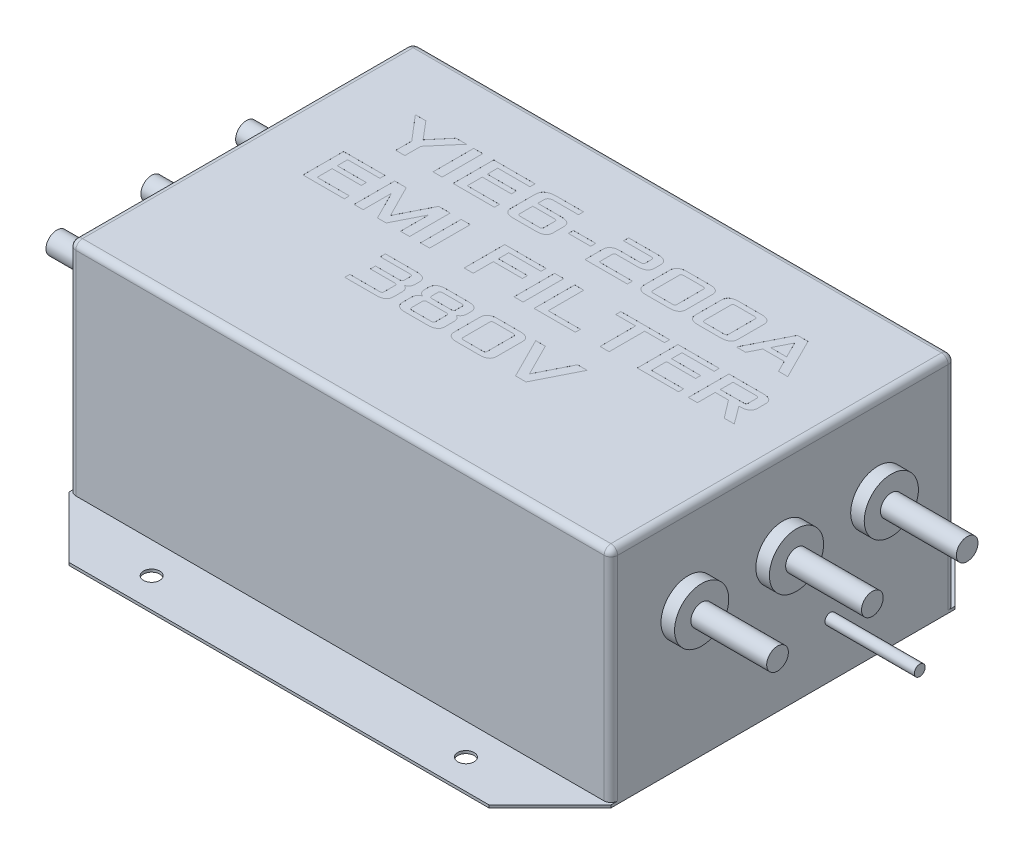
from build123d import *

# Parameters (mm, degrees)
SKETCH1_R           = 3
BOSS_EXTRUDE1_DEPTH = 1
SKETCH2_W           = 200
SKETCH2_H           = 127
BOSS_EXTRUDE2_DEPTH = 81
FILLET3_R           = 2.5
SKETCH3_R           = 4
SKETCH3_R_2         = 2
BOSS_EXTRUDE3_DEPTH = 133
BOSS_EXTRUDE4_START = -133
SKETCH3_2_R         = 4
BOSS_EXTRUDE4_DEPTH = 133
SKETCH4_W           = 3.359791589
SKETCH4_H           = 15
SKETCH4_W_2         = 8.227516457
SKETCH4_H_2         = 1.878310108
SKETCH4_W_3         = 3.35979159
CUT_EXTRUDE1_DEPTH  = 0.01
SKETCH5_R           = 10
BOSS_EXTRUDE5_DEPTH = 105


with BuildPart() as part:
    # Sketch1 → Boss-Extrude1 (new body)
    with BuildSketch(Plane(origin=(0, 0, 0), x_dir=(1, 0, 0), z_dir=(0, 1, 0))):
        Polygon((-77.5, 86), (77.5, 86), (100, 63.5), (100, -63.5), (77.5, -86), (-77.5, -86), (-100, -63.5), (-100, 63.5), align=None)
        with Locations(Location((-58, 75, 0), (0, 0, 270))):
            Circle(SKETCH1_R, mode=Mode.SUBTRACT)
        with Locations(Location((58, 75, 0), (0, 0, 90))):
            Circle(SKETCH1_R, mode=Mode.SUBTRACT)
        with Locations(Location((58, -75, 0), (0, 0, 270))):
            Circle(SKETCH1_R, mode=Mode.SUBTRACT)
        with Locations(Location((-58, -75, 0), (0, 0, 90))):
            Circle(SKETCH1_R, mode=Mode.SUBTRACT)
    extrude(amount=BOSS_EXTRUDE1_DEPTH)

    # Sketch2 → Boss-Extrude2 (add)
    with BuildSketch(Plane(origin=(0, 1, 0), x_dir=(1, 0, 0), z_dir=(0, 1, 0))):
        Rectangle(SKETCH2_W, SKETCH2_H)
    extrude(amount=BOSS_EXTRUDE2_DEPTH)

    # Fillet3
    fillet3_edges = [part.edges().sort_by_distance(p)[0] for p in [
        (-100, 41.5, -63.5),
        (-100, 41.5, 63.5),
        (100, 41.5, 63.5),
        (100, 41.5, -63.5),
        (-100, 82, 0),
        (0, 82, 63.5),
        (100, 82, 0),
        (0, 82, -63.5),
    ]]
    fillet(fillet3_edges, radius=FILLET3_R)

    # Sketch3 → Boss-Extrude3 (add)
    with BuildSketch(Plane(origin=(0, 0, 0), x_dir=(0, 0, -1), z_dir=(1, 0, 0))):
        with Locations(Location((-35, 50, 0), (0, 0, 180))):
            Circle(SKETCH3_R)
        with Locations(Location((35, 50, 0), (0, 0, 180))):
            Circle(SKETCH3_R)
        with Locations(Location((0, 50, 0), (0, 0, 180))):
            Circle(SKETCH3_R)
        with Locations(Location((17.5, 20, 0), (0, 0, 180))):
            Circle(SKETCH3_R_2)
    extrude(amount=BOSS_EXTRUDE3_DEPTH)

    # Sketch3<2> → Boss-Extrude4 (add)
    with BuildSketch(Plane(origin=(0, 0, 0), x_dir=(0, 0, -1), z_dir=(1, 0, 0)).offset(BOSS_EXTRUDE4_START)):
        with Locations(Location((-35, 50, 0), (0, 0, 180))):
            Circle(SKETCH3_2_R)
        with Locations(Location((35, 50, 0), (0, 0, 180))):
            Circle(SKETCH3_2_R)
        with Locations(Location((0, 50, 0), (0, 0, 180))):
            Circle(SKETCH3_2_R)
    extrude(amount=BOSS_EXTRUDE4_DEPTH)

    # Sketch4 → Cut-Extrude1 (cut)
    # profile 1 of 22: a face of its own
    with BuildSketch(Plane(origin=(0, 82, 0), x_dir=(1, 0, 0), z_dir=(0, 1, 0))):
        Polygon((-75.688497689, 40.013224284), (-67.916946143, 30.922589983), (-67.916946143, 25.013224284), (-64.557157783, 25.013224284), (-64.557157783, 30.922589983), (-56.785606237, 40.013224284), (-60.67138201, 40.013224284), (-66.237026128, 33.422706241), (-71.802721916, 40.013224284), align=None)
    # profile 2 of 22: a face of its own
    with BuildSketch(Plane(origin=(0, 82, 0), x_dir=(1, 0, 0), z_dir=(0, 1, 0))):
        with Locations((-52.480436592, 32.513224284)):
            Rectangle(SKETCH4_W, SKETCH4_H)
    # profile 3 of 22: a face of its own
    with BuildSketch(Plane(origin=(0, 82, 0), x_dir=(1, 0, 0), z_dir=(0, 1, 0))):
        Polygon((-46.752924979, 25.013227513), (-31.507231025, 25.013227513), (-31.507231025, 26.891534392), (-43.39313339, 26.891534392), (-43.39313339, 32.420631691), (-32.650106253, 32.420631691), (-32.650106253, 34.298941799), (-43.39313339, 34.298941799), (-43.39313339, 38.134914176), (-31.507231025, 38.134914176), (-31.507231025, 40.013224284), (-46.752924979, 40.013224284), align=None)
    # profile 4 of 22: a face of its own
    with BuildSketch(Plane(origin=(0, 82, 0), x_dir=(1, 0, 0), z_dir=(0, 1, 0))):
        with BuildLine():
            add(Edge.make_bspline(
                [(-28.128586355, 27.697876622), (-28.125461153, 27.587634896), (-28.119426591, 27.374765281), (-28.071589412, 27.066843581), (-27.997291669, 26.780933616), (-27.888296367, 26.517185867), (-27.759007455, 26.271018057), (-27.592929293, 26.050120776), (-27.399659783, 25.850149138), (-27.177818225, 25.672535736), (-26.93016046, 25.515769129), (-26.658072306, 25.381232351), (-26.363164747, 25.264587742), (-26.043769, 25.173329976), (-25.702299616, 25.100935805), (-25.336816207, 25.047540146), (-24.946734883, 25.018816898), (-24.678451135, 25.01512449), (-24.540620162, 25.013227513)],
                knots=[0, 0, 0, 0, 1.039968639, 2.008111906, 2.934259747, 3.821004225, 4.696138303, 5.551318514, 6.419499089, 7.314746791, 8.226763131, 9.180546054, 10.175484658, 11.215837561, 12.311571692, 13.468002448, 14.699184398, 16, 16, 16, 16], degree=3))
            Line((-24.540620162, 25.013227513), (-16.081715876, 25.013227513))
            add(Edge.make_bspline(
                [(-16.081715876, 25.013227513), (-15.944957725, 25.01514742), (-15.677747699, 25.018898702), (-15.2887363, 25.047539404), (-14.923252875, 25.100935988), (-14.581783495, 25.173329931), (-14.262387746, 25.264587754), (-13.967480187, 25.381232348), (-13.695392034, 25.51576913), (-13.447734269, 25.672535736), (-13.225892712, 25.850149138), (-13.032623196, 26.050120777), (-12.866545056, 26.271018055), (-12.737256061, 26.517185878), (-12.628261079, 26.780933574), (-12.553962068, 27.06684375), (-12.506271925, 27.373850936), (-12.500134801, 27.585790631), (-12.496969369, 27.69510582)],
                knots=[0, 0, 0, 0, 1.292219667, 2.524851705, 3.682644506, 4.779669194, 5.821247426, 6.817357869, 7.772264159, 8.685354672, 9.581656798, 10.450859917, 11.30704736, 12.183212171, 13.071001058, 13.998239717, 14.967523264, 16, 16, 16, 16], degree=3))
            Line((-12.496969369, 27.69510582), (-12.49366572, 31.61439603))
            add(Edge.make_bspline(
                [(-12.49366572, 31.61439603), (-12.498259877, 31.723473425), (-12.507173001, 31.935094423), (-12.553576394, 32.2421081), (-12.629205017, 32.528643028), (-12.735466639, 32.79363061), (-12.867687971, 33.038334607), (-13.032471573, 33.258820229), (-13.225936163, 33.458687621), (-13.447717672, 33.636348477), (-13.695414456, 33.793030312), (-13.967402942, 33.927875258), (-14.262984285, 34.043414709), (-14.581172488, 34.139602834), (-14.923024305, 34.212246382), (-15.289215081, 34.259080319), (-15.678591945, 34.294867327), (-15.947054803, 34.297559268), (-16.084932332, 34.298941799)],
                knots=[0, 0, 0, 0, 1.030299487, 1.99888351, 2.925452989, 3.822256577, 4.688646985, 5.544216526, 6.412792348, 7.30844762, 8.220879164, 9.175096306, 10.170487865, 11.214276539, 12.310509514, 13.466014488, 14.698592189, 16, 16, 16, 16], degree=3))
            Line((-16.084932332, 34.298941799), (-24.768794765, 34.298941799))
            Line((-24.768794765, 34.298941799), (-24.768794765, 36.507526378))
            add(Edge.make_bspline(
                [(-24.768794765, 36.507526378), (-24.763073886, 36.632977351), (-24.75220461, 36.871325521), (-24.653299519, 37.204701469), (-24.493105708, 37.49373793), (-24.256048909, 37.72468875), (-23.959327321, 37.90767448), (-23.598101571, 38.032114331), (-23.176509148, 38.116663413), (-22.873335923, 38.126419365), (-22.711916459, 38.131613757)],
                knots=[0, 0, 0, 0, 1.008225341, 1.915558388, 2.774473871, 3.64079039, 4.54985913, 5.560932089, 6.701359478, 8, 8, 8, 8], degree=3))
            Line((-22.711916459, 38.131613757), (-13.613563956, 38.134914176))
            Line((-13.613563956, 38.134914176), (-13.613563956, 40.013224284))
            Line((-13.613563956, 40.013224284), (-23.625758069, 40.013224284))
            add(Edge.make_bspline(
                [(-23.625758069, 40.013224284), (-23.799584275, 40.00908117), (-24.135860991, 40.001066081), (-24.626158639, 39.966946447), (-25.085730519, 39.900749043), (-25.515315556, 39.808265034), (-25.916837352, 39.693817128), (-26.285828308, 39.548091484), (-26.627922938, 39.378745561), (-26.938897932, 39.182197679), (-27.214178901, 38.954610098), (-27.460547867, 38.707201454), (-27.662672601, 38.424006596), (-27.832385537, 38.117296889), (-27.961387908, 37.78058646), (-28.057024203, 37.419353795), (-28.117375351, 37.030180065), (-28.126962317, 36.761683895), (-28.131890004, 36.623677249)],
                knots=[0, 0, 0, 0, 1.304266825, 2.523178617, 3.684378229, 4.783973007, 5.817572836, 6.81258112, 7.755550507, 8.677660593, 9.564891512, 10.430315211, 11.288718468, 12.165757005, 13.053296124, 13.985949166, 14.964780756, 16, 16, 16, 16], degree=3))
            Line((-28.131890004, 36.623677249), (-28.128586355, 27.697876622))
        make_face()
        with BuildLine():
            Line((-24.768794765, 27.582684875), (-24.768794765, 32.420631691))
            Line((-24.768794765, 32.420631691), (-16.767537893, 32.420631691))
            add(Edge.make_bspline(
                [(-16.767537893, 32.420631691), (-16.698619224, 32.417806419), (-16.568105021, 32.412456082), (-16.385652359, 32.380874642), (-16.229845243, 32.326769192), (-16.095471909, 32.256555771), (-15.99533724, 32.151776512), (-15.916345224, 32.031840345), (-15.869534769, 31.886914775), (-15.861168457, 31.783839006), (-15.856757728, 31.729497354)],
                knots=[0, 0, 0, 0, 1.28068808, 2.425293237, 3.422506462, 4.339334478, 5.208028714, 6.082734747, 6.989215783, 8, 8, 8, 8], degree=3))
            Line((-15.856757728, 31.729497354), (-15.853457309, 27.582684875))
            add(Edge.make_bspline(
                [(-15.853457309, 27.582684875), (-15.859261006, 27.528371635), (-15.870255312, 27.42548268), (-15.916191857, 27.280368402), (-15.995252338, 27.160165872), (-16.096356813, 27.056099722), (-16.228769383, 26.981274433), (-16.385838236, 26.928465736), (-16.568579309, 26.895429222), (-16.699860068, 26.8928838), (-16.769456141, 26.891534392)],
                knots=[0, 0, 0, 0, 1.010554323, 1.914356021, 2.786476635, 3.652603221, 4.576922577, 5.571188282, 6.712410263, 8, 8, 8, 8], degree=3))
            Line((-16.769456141, 26.891534392), (-23.854365409, 26.891534392))
            add(Edge.make_bspline(
                [(-23.854365409, 26.891534392), (-23.92454078, 26.892852706), (-24.056402911, 26.895329869), (-24.239713093, 26.928465106), (-24.396787306, 26.981274059), (-24.529181417, 27.056101572), (-24.630349983, 27.160159265), (-24.709169905, 27.280393734), (-24.756028485, 27.425235886), (-24.764387752, 27.528323867), (-24.768794765, 27.582684875)],
                knots=[0, 0, 0, 0, 1.29698023, 2.437074068, 3.430356903, 4.353762533, 5.21903292, 6.090291408, 6.993199663, 8, 8, 8, 8], degree=3))
        make_face(mode=Mode.SUBTRACT)
    # profile 5 of 22: a face of its own
    with BuildSketch(Plane(origin=(0, 82, 0), x_dir=(1, 0, 0), z_dir=(0, 1, 0))):
        with Locations((-5.390489502, 31.243384629)):
            Rectangle(SKETCH4_W_2, SKETCH4_H_2)
    # profile 6 of 22: a face of its own
    with BuildSketch(Plane(origin=(0, 82, 0), x_dir=(1, 0, 0), z_dir=(0, 1, 0))):
        with BuildLine():
            Line((1.924323698, 25.013227513), (17.559244333, 25.013227513))
            Line((17.559244333, 25.013227513), (17.559244333, 26.891534392))
            Line((17.559244333, 26.891534392), (5.284115288, 26.891534392))
            Line((5.284115288, 26.891534392), (5.284115288, 31.729587777))
            add(Edge.make_bspline(
                [(5.284115288, 31.729587777), (5.288528776, 31.783898972), (5.296902501, 31.886943763), (5.343702609, 32.031839659), (5.422694715, 32.151779036), (5.522829985, 32.256546175), (5.657200619, 32.326808654), (5.813019432, 32.38070305), (5.995990453, 32.413340131), (6.127236192, 32.415946385), (6.1968137, 32.417328042)],
                knots=[0, 0, 0, 0, 1.008946754, 1.914277678, 2.787873913, 3.655465979, 4.571130755, 5.56707875, 6.71023167, 8, 8, 8, 8], degree=3))
            Line((6.1968137, 32.417328042), (13.971194177, 32.420631691))
            add(Edge.make_bspline(
                [(13.971194177, 32.420631691), (14.108014279, 32.420598432), (14.37545505, 32.420533419), (14.763583203, 32.457852649), (15.130487977, 32.502441763), (15.470617724, 32.582117807), (15.790591793, 32.671635286), (16.085415763, 32.788727743), (16.357509821, 32.923162913), (16.605219222, 33.079917), (16.826856478, 33.257670689), (17.021485283, 33.457751708), (17.185225564, 33.6814419), (17.316690731, 33.928528418), (17.423832941, 34.194192914), (17.499503437, 34.481838786), (17.546347078, 34.790137325), (17.552687257, 35.003135194), (17.555940684, 35.112433862)],
                knots=[0, 0, 0, 0, 1.289612717, 2.520792012, 3.674986021, 4.772194003, 5.81183968, 6.806101929, 7.759236475, 8.67063283, 9.565271947, 10.432862337, 11.295830876, 12.170370041, 13.06615617, 13.991674421, 14.969438933, 16, 16, 16, 16], degree=3))
            Line((17.555940684, 35.112433862), (17.559244333, 37.321215433))
            add(Edge.make_bspline(
                [(17.559244333, 37.321215433), (17.55454573, 37.429463063), (17.545349381, 37.641330933), (17.499714413, 37.9487284), (17.423779656, 38.236359697), (17.31670445, 38.502027923), (17.18522196, 38.749113351), (17.02148632, 38.972804295), (16.826855917, 39.172883349), (16.60522044, 39.350644408), (16.357505362, 39.507369951), (16.085433481, 39.641918388), (15.790521272, 39.758559665), (15.471126858, 39.849818386), (15.129657088, 39.922212281), (14.764173791, 39.97560802), (14.374092435, 40.004331245), (14.105808691, 40.008023656), (13.967977721, 40.009920635)],
                knots=[0, 0, 0, 0, 1.021455309, 1.999245252, 2.924787575, 3.820597003, 4.695158915, 5.558149898, 6.425762854, 7.32042524, 8.2318453, 9.185004636, 10.179292746, 11.218965463, 12.313983199, 13.469657876, 14.700034876, 16, 16, 16, 16], degree=3))
            Line((13.967977721, 40.009920635), (3.044270375, 40.013224284))
            Line((3.044270375, 40.013224284), (3.044270375, 38.134914176))
            Line((3.044270375, 38.134914176), (13.28537216, 38.134914176))
            add(Edge.make_bspline(
                [(13.28537216, 38.134914176), (13.354244986, 38.131963233), (13.484672436, 38.126374905), (13.668068388, 38.096321355), (13.822376475, 38.036946862), (13.957541221, 37.96777619), (14.057485181, 37.862673824), (14.137403306, 37.742031489), (14.182836159, 37.59548573), (14.191585816, 37.491460717), (14.196152325, 37.437169312)],
                knots=[0, 0, 0, 0, 1.276480994, 2.417327238, 3.418155698, 4.331972828, 5.197814251, 6.069647727, 6.992535224, 8, 8, 8, 8], degree=3))
            Line((14.196152325, 37.437169312), (14.199452744, 34.996389561))
            add(Edge.make_bspline(
                [(14.199452744, 34.996389561), (14.19359898, 34.941098933), (14.182492523, 34.836194983), (14.137360483, 34.688753037), (14.058647775, 34.56765306), (13.955367309, 34.466800297), (13.823635319, 34.392610918), (13.66782312, 34.334774381), (13.484214573, 34.303189756), (13.353009736, 34.300413552), (13.283453912, 34.298941799)],
                knots=[0, 0, 0, 0, 1.024957902, 1.944671919, 2.81350747, 3.662112369, 4.582950044, 5.580337012, 6.717260293, 8, 8, 8, 8], degree=3))
            Line((13.283453912, 34.298941799), (5.512722627, 34.298941799))
            add(Edge.make_bspline(
                [(5.512722627, 34.298941799), (5.374700692, 34.29756314), (5.106093287, 34.294880102), (4.71657262, 34.259080424), (4.350381869, 34.212246356), (4.008530046, 34.13960284), (3.690341844, 34.043414708), (3.394760501, 33.927875259), (3.122772015, 33.793030312), (2.875075232, 33.636348477), (2.653293722, 33.458687621), (2.459829135, 33.258820229), (2.295045517, 33.038334607), (2.162824246, 32.793630609), (2.05656239, 32.528643031), (1.980934685, 32.242108086), (1.934495737, 31.934883597), (1.925606316, 31.723047807), (1.921020049, 31.613756614)],
                knots=[0, 0, 0, 0, 1.302495012, 2.534813073, 3.690074641, 4.786076696, 5.829645498, 6.824827379, 7.778843516, 8.691082858, 9.586549462, 10.45494232, 11.310331636, 12.176539541, 13.073154217, 13.999528516, 14.967908509, 16, 16, 16, 16], degree=3))
            Line((1.921020049, 31.613756614), (1.924323698, 25.013227513))
        make_face()
    # profile 7 of 22: a face of its own
    with BuildSketch(Plane(origin=(0, 82, 0), x_dir=(1, 0, 0), z_dir=(0, 1, 0))):
        with BuildLine():
            add(Edge.make_bspline(
                [(20.971942746, 27.694598808), (20.975118189, 27.584363697), (20.981249504, 27.371515867), (21.028241549, 27.064418732), (21.104780783, 26.779293338), (21.210391622, 26.515215511), (21.342677928, 26.270531808), (21.50744487, 26.050042105), (21.700912518, 25.850171074), (21.922698925, 25.672529668), (22.170372028, 25.515770849), (22.442455826, 25.381231859), (22.73736463, 25.264587883), (23.056760021, 25.173329935), (23.398229508, 25.100935817), (23.763712887, 25.047540143), (24.15379422, 25.018816899), (24.422077966, 25.015124491), (24.559908938, 25.013227513)],
                knots=[0, 0, 0, 0, 1.040674086, 2.009389013, 2.926031417, 3.822956207, 4.689463707, 5.545148877, 6.413842087, 7.309618406, 8.222173265, 9.176519368, 10.172045454, 11.213012655, 12.309393785, 13.466507378, 14.698416305, 16, 16, 16, 16], degree=3))
            Line((24.559908938, 25.013227513), (33.018813225, 25.013227513))
            add(Edge.make_bspline(
                [(33.018813225, 25.013227513), (33.155571375, 25.01514742), (33.4227814, 25.018898703), (33.811792808, 25.047539401), (34.177276203, 25.100936), (34.518745686, 25.17332989), (34.838141078, 25.264587894), (35.133049881, 25.381231856), (35.405133679, 25.515770849), (35.652806783, 25.672529668), (35.874593187, 25.850171073), (36.068060843, 26.050042106), (36.232827759, 26.270531806), (36.365114162, 26.515215519), (36.470724625, 26.779293308), (36.547265328, 27.06441885), (36.59411006, 27.370591476), (36.600344239, 27.582499888), (36.603559732, 27.691798942)],
                knots=[0, 0, 0, 0, 1.292990977, 2.526358757, 3.68484263, 4.782522118, 5.824722055, 6.821427064, 7.776903325, 8.690538851, 9.587375968, 10.457097903, 11.313796394, 12.181330032, 13.079316979, 13.997044892, 14.966906992, 16, 16, 16, 16], degree=3))
            Line((36.603559732, 27.691798942), (36.606863381, 37.331371812))
            add(Edge.make_bspline(
                [(36.606863381, 37.331371812), (36.602244727, 37.440646589), (36.59329223, 37.652457674), (36.547467952, 37.958740563), (36.470672814, 38.24385196), (36.365127403, 38.507933366), (36.232824314, 38.752616151), (36.068061776, 38.973106094), (35.874592927, 39.17297706), (35.652806855, 39.350618484), (35.405133659, 39.507377298), (35.133049887, 39.641916289), (34.838141076, 39.758560265), (34.518745687, 39.849818213), (34.177276199, 39.922212331), (33.81179282, 39.975608005), (33.421711487, 40.004331249), (33.153427741, 40.008023657), (33.015596769, 40.009920635)],
                knots=[0, 0, 0, 0, 1.032912464, 2.002130007, 2.91924801, 3.816638167, 4.683595254, 5.539724395, 6.408868325, 7.305109416, 8.218137752, 9.172979016, 10.169021629, 11.210528934, 12.30747892, 13.465192879, 14.69774098, 16, 16, 16, 16], degree=3))
            Line((33.015596769, 40.009920635), (24.560341674, 40.013224284))
            add(Edge.make_bspline(
                [(24.560341674, 40.013224284), (24.422374832, 40.009926428), (24.153992199, 40.003511211), (23.76370719, 39.975811552), (23.39823091, 39.922162246), (23.056759673, 39.849830609), (22.737364718, 39.75855717), (22.442455799, 39.641917067), (22.170372054, 39.507377103), (21.922698851, 39.350618534), (21.700912781, 39.172977047), (21.507443931, 38.973106097), (21.342681396, 38.752616149), (21.210378293, 38.507933367), (21.104832935, 38.243851957), (21.02803759, 37.958740573), (20.982213023, 37.652450109), (20.973258798, 37.440631524), (20.968639097, 37.331349206)],
                knots=[0, 0, 0, 0, 1.303771845, 2.53618707, 3.693776222, 4.79060795, 5.832002974, 6.827938208, 7.782676535, 8.695606442, 9.591750913, 10.460801145, 11.31683799, 12.183701614, 13.080995028, 13.99801416, 14.967127216, 16, 16, 16, 16], degree=3))
            Line((20.968639097, 37.331349206), (20.971942746, 27.694598808))
        make_face()
        with BuildLine():
            Line((24.331734335, 27.57987532), (24.331734335, 37.4460953))
            add(Edge.make_bspline(
                [(24.331734335, 37.4460953), (24.336194291, 37.499680421), (24.344711007, 37.602006367), (24.391533951, 37.745879349), (24.4691077, 37.866296904), (24.572634889, 37.966820996), (24.703560343, 38.042056713), (24.860874108, 38.094623992), (25.043537908, 38.127736676), (25.174830436, 38.130270498), (25.244432748, 38.131613757)],
                knots=[0, 0, 0, 0, 0.997524588, 1.904869231, 2.780408599, 3.635561217, 4.56350395, 5.561667223, 6.707362849, 8, 8, 8, 8], degree=3))
            Line((25.244432748, 38.131613757), (32.332991207, 38.134914176))
            add(Edge.make_bspline(
                [(32.332991207, 38.134914176), (32.40193441, 38.132128231), (32.532495133, 38.126852367), (32.714640997, 38.094795255), (32.87194329, 38.042016804), (33.002870923, 37.966830426), (33.106399306, 37.866294475), (33.183966188, 37.745879752), (33.231057022, 37.601271421), (33.239382285, 37.498149207), (33.243771372, 37.443783069)],
                knots=[0, 0, 0, 0, 1.281347548, 2.426543243, 3.424270962, 4.351808781, 5.206588248, 6.081745569, 6.988694288, 8, 8, 8, 8], degree=3))
            Line((33.243771372, 37.443783069), (33.247071792, 27.57987532))
            add(Edge.make_bspline(
                [(33.247071792, 27.57987532), (33.241300968, 27.525375825), (33.230384414, 27.422280198), (33.184154998, 27.277243974), (33.106351043, 27.156857607), (33.002884428, 27.056325308), (32.871941295, 26.981091986), (32.714632898, 26.92852398), (32.531967404, 26.895411525), (32.400675135, 26.892877669), (32.331072959, 26.891534392)],
                knots=[0, 0, 0, 0, 1.015024156, 1.920101296, 2.793452643, 3.646468188, 4.572091941, 5.56776075, 6.71059322, 8, 8, 8, 8], degree=3))
            Line((32.331072959, 26.891534392), (25.246163692, 26.891534392))
            add(Edge.make_bspline(
                [(25.246163692, 26.891534392), (25.175982148, 26.892846502), (25.044108418, 26.895312008), (24.860873944, 26.928523334), (24.703560266, 26.98109162), (24.572635294, 27.056327129), (24.469106266, 27.15685118), (24.391539557, 27.277269093), (24.344448675, 27.421876526), (24.336123419, 27.524998872), (24.331734335, 27.57987532)],
                knots=[0, 0, 0, 0, 1.299302565, 2.441437824, 3.436499202, 4.361558256, 5.214053399, 6.086871938, 6.991396915, 8, 8, 8, 8], degree=3))
        make_face(mode=Mode.SUBTRACT)
    # profile 8 of 22: a face of its own
    with BuildSketch(Plane(origin=(0, 82, 0), x_dir=(1, 0, 0), z_dir=(0, 1, 0))):
        with BuildLine():
            add(Edge.make_bspline(
                [(40.019561794, 27.694598808), (40.022737237, 27.584363697), (40.028868551, 27.371515867), (40.075860597, 27.064418732), (40.152399831, 26.779293338), (40.258010669, 26.515215511), (40.390296976, 26.270531808), (40.555063918, 26.050042105), (40.748531566, 25.850171074), (40.970317973, 25.672529668), (41.217991076, 25.515770849), (41.490074874, 25.381231859), (41.784983678, 25.264587883), (42.104379068, 25.173329935), (42.445848555, 25.100935817), (42.811331935, 25.047540143), (43.201413267, 25.018816899), (43.469697014, 25.015124491), (43.607527986, 25.013227513)],
                knots=[0, 0, 0, 0, 1.040674086, 2.009389013, 2.926031417, 3.822956207, 4.689463707, 5.545148877, 6.413842087, 7.309618406, 8.222173265, 9.176519368, 10.172045454, 11.213012655, 12.309393785, 13.466507378, 14.698416305, 16, 16, 16, 16], degree=3))
            Line((43.607527986, 25.013227513), (52.066432272, 25.013227513))
            add(Edge.make_bspline(
                [(52.066432272, 25.013227513), (52.203190423, 25.01514742), (52.470400447, 25.018898703), (52.859411855, 25.047539401), (53.22489525, 25.100936), (53.566364734, 25.17332989), (53.885760125, 25.264587894), (54.180668928, 25.381231856), (54.452752727, 25.515770849), (54.70042583, 25.672529668), (54.922212235, 25.850171073), (55.11567989, 26.050042106), (55.280446807, 26.270531806), (55.41273321, 26.515215519), (55.518343673, 26.779293308), (55.594884375, 27.06441885), (55.641729107, 27.370591476), (55.647963287, 27.582499888), (55.65117878, 27.691798942)],
                knots=[0, 0, 0, 0, 1.292990977, 2.526358757, 3.68484263, 4.782522118, 5.824722055, 6.821427064, 7.776903325, 8.690538851, 9.587375968, 10.457097903, 11.313796394, 12.181330032, 13.079316979, 13.997044892, 14.966906992, 16, 16, 16, 16], degree=3))
            Line((55.65117878, 27.691798942), (55.654482429, 37.331371812))
            add(Edge.make_bspline(
                [(55.654482429, 37.331371812), (55.649863775, 37.440646589), (55.640911278, 37.652457674), (55.595087, 37.958740563), (55.518291862, 38.24385196), (55.412746451, 38.507933366), (55.280443362, 38.752616151), (55.115680823, 38.973106094), (54.922211975, 39.17297706), (54.700425902, 39.350618484), (54.452752706, 39.507377298), (54.180668934, 39.641916289), (53.885760123, 39.758560265), (53.566364735, 39.849818213), (53.224895247, 39.922212331), (52.859411868, 39.975608005), (52.469330535, 40.004331249), (52.201046788, 40.008023657), (52.063215817, 40.009920635)],
                knots=[0, 0, 0, 0, 1.032912464, 2.002130007, 2.91924801, 3.816638167, 4.683595254, 5.539724395, 6.408868325, 7.305109416, 8.218137752, 9.172979016, 10.169021629, 11.210528934, 12.30747892, 13.465192879, 14.69774098, 16, 16, 16, 16], degree=3))
            Line((52.063215817, 40.009920635), (43.607960722, 40.013224284))
            add(Edge.make_bspline(
                [(43.607960722, 40.013224284), (43.46999388, 40.009926428), (43.201611247, 40.003511211), (42.811326237, 39.975811552), (42.445849957, 39.922162246), (42.104378721, 39.849830609), (41.784983766, 39.75855717), (41.490074846, 39.641917067), (41.217991101, 39.507377103), (40.970317899, 39.350618534), (40.748531828, 39.172977047), (40.555062978, 38.973106097), (40.390300444, 38.752616149), (40.257997341, 38.507933367), (40.152451983, 38.243851957), (40.075656638, 37.958740573), (40.02983207, 37.652450109), (40.020877845, 37.440631524), (40.016258145, 37.331349206)],
                knots=[0, 0, 0, 0, 1.303771845, 2.53618707, 3.693776222, 4.79060795, 5.832002974, 6.827938208, 7.782676535, 8.695606442, 9.591750913, 10.460801145, 11.31683799, 12.183701614, 13.080995028, 13.99801416, 14.967127216, 16, 16, 16, 16], degree=3))
            Line((40.016258145, 37.331349206), (40.019561794, 27.694598808))
        make_face()
        with BuildLine():
            Line((43.379353383, 27.57987532), (43.379353383, 37.4460953))
            add(Edge.make_bspline(
                [(43.379353383, 37.4460953), (43.383813339, 37.499680421), (43.392330055, 37.602006367), (43.439152999, 37.745879349), (43.516726747, 37.866296904), (43.620253937, 37.966820996), (43.75117939, 38.042056713), (43.908493156, 38.094623992), (44.091156956, 38.127736676), (44.222449483, 38.130270498), (44.292051795, 38.131613757)],
                knots=[0, 0, 0, 0, 0.997524588, 1.904869231, 2.780408599, 3.635561217, 4.56350395, 5.561667223, 6.707362849, 8, 8, 8, 8], degree=3))
            Line((44.292051795, 38.131613757), (51.380610255, 38.134914176))
            add(Edge.make_bspline(
                [(51.380610255, 38.134914176), (51.449553458, 38.132128231), (51.580114181, 38.126852367), (51.762260045, 38.094795255), (51.919562337, 38.042016804), (52.05048997, 37.966830426), (52.154018354, 37.866294475), (52.231585236, 37.745879752), (52.278676069, 37.601271421), (52.287001332, 37.498149207), (52.29139042, 37.443783069)],
                knots=[0, 0, 0, 0, 1.281347548, 2.426543243, 3.424270962, 4.351808781, 5.206588248, 6.081745569, 6.988694288, 8, 8, 8, 8], degree=3))
            Line((52.29139042, 37.443783069), (52.294690839, 27.57987532))
            add(Edge.make_bspline(
                [(52.294690839, 27.57987532), (52.288920015, 27.525375825), (52.278003461, 27.422280198), (52.231774046, 27.277243974), (52.153970091, 27.156857607), (52.050503475, 27.056325308), (51.919560343, 26.981091986), (51.762251946, 26.92852398), (51.579586452, 26.895411525), (51.448294182, 26.892877669), (51.378692007, 26.891534392)],
                knots=[0, 0, 0, 0, 1.015024156, 1.920101296, 2.793452643, 3.646468188, 4.572091941, 5.56776075, 6.71059322, 8, 8, 8, 8], degree=3))
            Line((51.378692007, 26.891534392), (44.29378274, 26.891534392))
            add(Edge.make_bspline(
                [(44.29378274, 26.891534392), (44.223601196, 26.892846502), (44.091727465, 26.895312008), (43.908492992, 26.928523334), (43.751179313, 26.98109162), (43.620254342, 27.056327129), (43.516725314, 27.15685118), (43.439158604, 27.277269093), (43.392067722, 27.421876526), (43.383742466, 27.524998872), (43.379353383, 27.57987532)],
                knots=[0, 0, 0, 0, 1.299302565, 2.441437824, 3.436499202, 4.361558256, 5.214053399, 6.086871938, 6.991396915, 8, 8, 8, 8], degree=3))
        make_face(mode=Mode.SUBTRACT)
    # profile 9 of 22: a face of its own
    with BuildSketch(Plane(origin=(0, 82, 0), x_dir=(1, 0, 0), z_dir=(0, 1, 0))):
        Polygon((57.801050121, 25.013224284), (61.229675803, 25.013224284), (63.332566222, 29.246028517), (71.241262795, 29.246028517), (73.344153213, 25.013224284), (76.772778895, 25.013224284), (69.229802395, 40.013224284), (65.344026622, 40.013224284), align=None)
        Polygon((64.315438917, 31.124338624), (67.286914508, 37.050497065), (70.258390099, 31.124338624), align=None, mode=Mode.SUBTRACT)
    # profile 10 of 22: a face of its own
    with BuildSketch(Plane(origin=(0, 82, 0), x_dir=(1, 0, 0), z_dir=(0, 1, 0))):
        with BuildLine():
            Line((-36.740406178, -24.986772487), (-25.083078859, -24.986772487))
            add(Edge.make_bspline(
                [(-25.083078859, -24.986772487), (-24.946215149, -24.984854832), (-24.678899475, -24.981109361), (-24.289782803, -24.952460519), (-23.92429938, -24.899064031), (-23.582829999, -24.826670065), (-23.263434251, -24.735412248), (-22.968526692, -24.618767652), (-22.696438539, -24.48423087), (-22.448780773, -24.327464264), (-22.226939217, -24.149850862), (-22.033669701, -23.949879223), (-21.867591561, -23.728981945), (-21.738302566, -23.482814122), (-21.629307583, -23.219066426), (-21.555008572, -22.93315625), (-21.507318429, -22.626149064), (-21.501181306, -22.414209369), (-21.498015873, -22.30489418)],
                knots=[0, 0, 0, 0, 1.293135658, 2.525690929, 3.683411623, 4.780367989, 5.821881352, 6.817929758, 7.772776577, 8.685810223, 9.582056528, 10.451205513, 11.307339634, 12.183449878, 13.071183474, 13.998364386, 14.967587566, 16, 16, 16, 16], degree=3))
            Line((-21.498015873, -22.30489418), (-21.494712224, -18.961562707))
            add(Edge.make_bspline(
                [(-21.494712224, -18.961562707), (-21.504648346, -18.800147129), (-21.523482589, -18.494178649), (-21.618382914, -18.063277515), (-21.772776253, -17.689346628), (-21.989694133, -17.376106594), (-22.250138936, -17.119430026), (-22.529211857, -16.895295246), (-22.840052703, -16.716250085), (-23.061984628, -16.630709066), (-23.174603175, -16.587301587)],
                knots=[0, 0, 0, 0, 1.241160918, 2.3526609, 3.373512588, 4.329604765, 5.257834727, 6.174440217, 7.073626345, 8, 8, 8, 8], degree=3))
            add(Edge.make_bspline(
                [(-23.174603175, -16.587301587), (-23.061595827, -16.544526677), (-22.837851813, -16.459836343), (-22.532428577, -16.271073589), (-22.247665981, -16.052659975), (-21.989996531, -15.791193473), (-21.772593195, -15.475319693), (-21.618618278, -15.097941346), (-21.522723099, -14.664001677), (-21.506545988, -14.355691963), (-21.498015873, -14.193121693)],
                knots=[0, 0, 0, 0, 0.921722229, 1.824924092, 2.731735011, 3.66131978, 4.619564772, 5.643055426, 6.757194147, 8, 8, 8, 8], degree=3))
            Line((-21.498015873, -14.193121693), (-21.494712224, -12.678784567))
            add(Edge.make_bspline(
                [(-21.494712224, -12.678784567), (-21.499410827, -12.570536937), (-21.508607177, -12.358669067), (-21.554242144, -12.0512716), (-21.630176901, -11.763640303), (-21.737252107, -11.497972077), (-21.868734597, -11.250886649), (-22.032470238, -11.027195705), (-22.22710064, -10.827116651), (-22.448736118, -10.649355592), (-22.696451195, -10.492630049), (-22.968523076, -10.358081612), (-23.263435285, -10.241440335), (-23.5828297, -10.150181614), (-23.924299469, -10.077787719), (-24.289782766, -10.02439198), (-24.679864123, -9.995668755), (-24.948147866, -9.991976344), (-25.085978836, -9.990079365)],
                knots=[0, 0, 0, 0, 1.021455309, 1.999245252, 2.924787575, 3.820597003, 4.695158915, 5.558149898, 6.425762854, 7.32042524, 8.2318453, 9.185004636, 10.179292746, 11.218965463, 12.313983199, 13.469657876, 14.700034876, 16, 16, 16, 16], degree=3))
            Line((-25.085978836, -9.990079365), (-36.740406178, -9.986775716))
            Line((-36.740406178, -9.986775716), (-36.740406178, -11.865085824))
            Line((-36.740406178, -11.865085824), (-25.768803995, -11.865085824))
            add(Edge.make_bspline(
                [(-25.768803995, -11.865085824), (-25.699857781, -11.868033232), (-25.569356575, -11.873612078), (-25.385888193, -11.903678894), (-25.231580077, -11.963053081), (-25.096415337, -12.032223823), (-24.996471376, -12.137326172), (-24.916553252, -12.257968512), (-24.871120399, -12.40451427), (-24.862370742, -12.508539283), (-24.857804233, -12.562830688)],
                knots=[0, 0, 0, 0, 1.277617459, 2.418270868, 3.41893016, 4.332592829, 5.198287899, 6.069974011, 6.992705514, 8, 8, 8, 8], degree=3))
            Line((-24.857804233, -12.562830688), (-24.854503813, -15.003610439))
            add(Edge.make_bspline(
                [(-24.854503813, -15.003610439), (-24.860357577, -15.058901067), (-24.871464034, -15.163805017), (-24.916596075, -15.311246963), (-24.995308783, -15.43234694), (-25.098589248, -15.533199703), (-25.230321238, -15.607389082), (-25.386133437, -15.665225619), (-25.569741984, -15.696810244), (-25.700946821, -15.699586448), (-25.770502646, -15.701058201)],
                knots=[0, 0, 0, 0, 1.024957902, 1.944671919, 2.81350747, 3.662112369, 4.582950044, 5.580337012, 6.717260293, 8, 8, 8, 8], degree=3))
            Line((-25.770502646, -15.701058201), (-34.683230768, -15.701058201))
            Line((-34.683230768, -15.701058201), (-34.683230768, -17.579368309))
            Line((-34.683230768, -17.579368309), (-25.768803995, -17.579368309))
            add(Edge.make_bspline(
                [(-25.768803995, -17.579368309), (-25.699811869, -17.582189853), (-25.569223821, -17.587530462), (-25.386698872, -17.619125563), (-25.230891746, -17.673230761), (-25.096518414, -17.743444241), (-24.996383745, -17.848223485), (-24.917391728, -17.968159656), (-24.870581273, -18.113085225), (-24.862214961, -18.216160994), (-24.857804233, -18.270502646)],
                knots=[0, 0, 0, 0, 1.281827574, 2.426238623, 3.423282736, 4.339955272, 5.208502191, 6.083059886, 6.989387197, 8, 8, 8, 8], degree=3))
            Line((-24.857804233, -18.270502646), (-24.854503813, -22.417315125))
            add(Edge.make_bspline(
                [(-24.854503813, -22.417315125), (-24.860307511, -22.471628365), (-24.871301817, -22.57451732), (-24.917238362, -22.719631598), (-24.996298843, -22.839834128), (-25.097403317, -22.943900278), (-25.229815888, -23.018725567), (-25.38688474, -23.071534264), (-25.569625813, -23.104570778), (-25.700906572, -23.1071162), (-25.770502646, -23.108465608)],
                knots=[0, 0, 0, 0, 1.010554323, 1.914356021, 2.786476635, 3.652603221, 4.576922577, 5.571188282, 6.712410263, 8, 8, 8, 8], degree=3))
            Line((-25.770502646, -23.108465608), (-36.740406178, -23.108465608))
            Line((-36.740406178, -23.108465608), (-36.740406178, -24.986772487))
        make_face()
    # profile 11 of 22: a face of its own
    with BuildSketch(Plane(origin=(0, 82, 0), x_dir=(1, 0, 0), z_dir=(0, 1, 0))):
        with BuildLine():
            add(Edge.make_bspline(
                [(-18.082013811, -22.302123378), (-18.078888609, -22.412365104), (-18.072854048, -22.625234719), (-18.025016869, -22.933156419), (-17.950719126, -23.219066384), (-17.841723823, -23.482814133), (-17.712434912, -23.728981943), (-17.54635675, -23.949879224), (-17.353087239, -24.149850862), (-17.131245681, -24.327464264), (-16.883587917, -24.484230871), (-16.611499763, -24.618767649), (-16.316592204, -24.735412258), (-15.997196457, -24.826670024), (-15.655727073, -24.899064195), (-15.290243663, -24.952459854), (-14.900162339, -24.981183102), (-14.631878592, -24.98487551), (-14.494047619, -24.986772487)],
                knots=[0, 0, 0, 0, 1.039968639, 2.008111906, 2.934259747, 3.821004225, 4.696138303, 5.551318514, 6.419499089, 7.314746791, 8.226763131, 9.180546054, 10.175484658, 11.215837561, 12.311571692, 13.468002448, 14.699184398, 16, 16, 16, 16], degree=3))
            Line((-14.494047619, -24.986772487), (-6.035143333, -24.986772487))
            add(Edge.make_bspline(
                [(-6.035143333, -24.986772487), (-5.898385182, -24.98485258), (-5.631175156, -24.981101298), (-5.242163756, -24.952460596), (-4.876680332, -24.899064012), (-4.535210951, -24.826670069), (-4.215815203, -24.735412246), (-3.920907644, -24.618767652), (-3.648819491, -24.48423087), (-3.401161726, -24.327464264), (-3.179320169, -24.149850862), (-2.986050653, -23.949879223), (-2.819972513, -23.728981945), (-2.690683518, -23.482814122), (-2.581688536, -23.219066426), (-2.507389525, -22.93315625), (-2.459699382, -22.626149064), (-2.453562258, -22.414209369), (-2.450396825, -22.30489418)],
                knots=[0, 0, 0, 0, 1.292219667, 2.524851705, 3.682644506, 4.779669194, 5.821247426, 6.817357869, 7.772264159, 8.685354672, 9.581656798, 10.450859917, 11.30704736, 12.183212171, 13.071001058, 13.998239717, 14.967523264, 16, 16, 16, 16], degree=3))
            Line((-2.450396825, -22.30489418), (-2.447093176, -18.961562707))
            add(Edge.make_bspline(
                [(-2.447093176, -18.961562707), (-2.457029298, -18.800147129), (-2.475863541, -18.494178649), (-2.570763866, -18.063277515), (-2.725157205, -17.689346628), (-2.942075085, -17.376106594), (-3.202519888, -17.119430026), (-3.481592809, -16.895295246), (-3.792433655, -16.716250085), (-4.014365581, -16.630709066), (-4.126984127, -16.587301587)],
                knots=[0, 0, 0, 0, 1.241160918, 2.3526609, 3.373512588, 4.329604765, 5.257834727, 6.174440217, 7.073626345, 8, 8, 8, 8], degree=3))
            add(Edge.make_bspline(
                [(-4.126984127, -16.587301587), (-4.013976779, -16.544526677), (-3.790232765, -16.459836343), (-3.48480953, -16.271073589), (-3.200046933, -16.052659975), (-2.942377484, -15.791193473), (-2.724974147, -15.475319693), (-2.570999231, -15.097941346), (-2.475104051, -14.664001677), (-2.45892694, -14.355691963), (-2.450396825, -14.193121693)],
                knots=[0, 0, 0, 0, 0.921722229, 1.824924092, 2.731735011, 3.66131978, 4.619564772, 5.643055426, 6.757194147, 8, 8, 8, 8], degree=3))
            Line((-2.450396825, -14.193121693), (-2.447093176, -12.678784567))
            add(Edge.make_bspline(
                [(-2.447093176, -12.678784567), (-2.45179178, -12.570536937), (-2.460988129, -12.358669067), (-2.506623097, -12.0512716), (-2.582557854, -11.763640303), (-2.689633059, -11.497972077), (-2.82111555, -11.250886649), (-2.98485119, -11.027195705), (-3.179481592, -10.827116651), (-3.40111707, -10.649355592), (-3.648832147, -10.492630049), (-3.920904029, -10.358081612), (-4.215816238, -10.241440335), (-4.535210652, -10.150181614), (-4.876680421, -10.077787719), (-5.242163719, -10.02439198), (-5.632245075, -9.995668755), (-5.900528818, -9.991976344), (-6.038359788, -9.990079365)],
                knots=[0, 0, 0, 0, 1.021455309, 1.999245252, 2.924787575, 3.820597003, 4.695158915, 5.558149898, 6.425762854, 7.32042524, 8.2318453, 9.185004636, 10.179292746, 11.218965463, 12.313983199, 13.469657876, 14.700034876, 16, 16, 16, 16], degree=3))
            Line((-6.038359788, -9.990079365), (-14.493614883, -9.986775716))
            add(Edge.make_bspline(
                [(-14.493614883, -9.986775716), (-14.631581723, -9.990073573), (-14.899964353, -9.996488793), (-15.290249386, -10.024188433), (-15.655725584, -10.077837804), (-15.997197102, -10.150169218), (-16.316591083, -10.241443431), (-16.611503401, -10.358080834), (-16.883575255, -10.492630244), (-17.131290337, -10.649355542), (-17.352925821, -10.827116664), (-17.547556196, -11.027195702), (-17.711291937, -11.250886647), (-17.842774043, -11.497972087), (-17.949850738, -11.763640263), (-18.025779621, -12.051271758), (-18.071589784, -12.359688875), (-18.08066123, -12.572596296), (-18.08531746, -12.681878307)],
                knots=[0, 0, 0, 0, 1.300692135, 2.530196207, 3.685050955, 4.779291798, 5.818226888, 6.81180957, 7.764292658, 8.675066084, 9.569093725, 10.436091126, 11.298469835, 12.172411262, 13.067585131, 13.9924708, 14.96956702, 16, 16, 16, 16], degree=3))
            Line((-18.08531746, -12.681878307), (-18.082013811, -14.189921384))
            add(Edge.make_bspline(
                [(-18.082013811, -14.189921384), (-18.075379736, -14.353685224), (-18.062824, -14.663626748), (-17.960290998, -15.097466212), (-17.80771787, -15.475368654), (-17.589978775, -15.791215893), (-17.332299894, -16.0525296), (-17.047129267, -16.272138788), (-16.739436217, -16.458954428), (-16.515016798, -16.544344001), (-16.402116402, -16.587301587)],
                knots=[0, 0, 0, 0, 1.247693063, 2.361399734, 3.382771428, 4.339032541, 5.266692766, 6.17162629, 7.080186036, 8, 8, 8, 8], degree=3))
            add(Edge.make_bspline(
                [(-16.402116402, -16.587301587), (-16.514632974, -16.630889461), (-16.73725645, -16.717131725), (-17.050333231, -16.894218007), (-17.329832739, -17.119556397), (-17.590279603, -17.376085695), (-17.807534705, -17.689296454), (-17.960530614, -18.063757454), (-18.06181433, -18.493518573), (-18.077205783, -18.800076548), (-18.08531746, -18.961640212)],
                knots=[0, 0, 0, 0, 0.925364295, 1.830910878, 2.746517651, 3.673736231, 4.628786666, 5.648526054, 6.76071485, 8, 8, 8, 8], degree=3))
            Line((-18.08531746, -18.961640212), (-18.082013811, -22.302123378))
        make_face()
        with BuildLine():
            Line((-14.722222222, -22.417315125), (-14.722222222, -18.270412223))
            add(Edge.make_bspline(
                [(-14.722222222, -18.270412223), (-14.717808734, -18.216101028), (-14.709435009, -18.113056237), (-14.662634901, -17.968160341), (-14.583642795, -17.848220964), (-14.483507525, -17.743453825), (-14.349136891, -17.673191346), (-14.193318078, -17.61929695), (-14.010347057, -17.586659869), (-13.879101318, -17.584053615), (-13.80952381, -17.582671958)],
                knots=[0, 0, 0, 0, 1.008946754, 1.914277678, 2.787873913, 3.655465979, 4.571130755, 5.56707875, 6.71023167, 8, 8, 8, 8], degree=3))
            Line((-13.80952381, -17.582671958), (-6.72096535, -17.579368309))
            add(Edge.make_bspline(
                [(-6.72096535, -17.579368309), (-6.65204668, -17.582193581), (-6.521532478, -17.587543918), (-6.339079816, -17.619125358), (-6.1832727, -17.673230808), (-6.048899366, -17.743444229), (-5.948764697, -17.848223488), (-5.869772681, -17.968159655), (-5.822962226, -18.113085225), (-5.814595914, -18.216160994), (-5.810185185, -18.270502646)],
                knots=[0, 0, 0, 0, 1.28068808, 2.425293237, 3.422506462, 4.339334478, 5.208028714, 6.082734747, 6.989215783, 8, 8, 8, 8], degree=3))
            Line((-5.810185185, -18.270502646), (-5.806884766, -22.417315125))
            add(Edge.make_bspline(
                [(-5.806884766, -22.417315125), (-5.812688463, -22.471628365), (-5.823682769, -22.57451732), (-5.869619314, -22.719631598), (-5.948679795, -22.839834128), (-6.04978427, -22.943900278), (-6.18219684, -23.018725567), (-6.339265692, -23.071534264), (-6.522006765, -23.104570778), (-6.653287525, -23.1071162), (-6.722883598, -23.108465608)],
                knots=[0, 0, 0, 0, 1.010554323, 1.914356021, 2.786476635, 3.652603221, 4.576922577, 5.571188282, 6.712410263, 8, 8, 8, 8], degree=3))
            Line((-6.722883598, -23.108465608), (-13.807792865, -23.108465608))
            add(Edge.make_bspline(
                [(-13.807792865, -23.108465608), (-13.877968236, -23.107147294), (-14.009830368, -23.104670131), (-14.19314055, -23.071534894), (-14.350214763, -23.018725941), (-14.482608874, -22.943898428), (-14.583777439, -22.839840735), (-14.662597362, -22.719606266), (-14.709455942, -22.574764114), (-14.717815208, -22.471676133), (-14.722222222, -22.417315125)],
                knots=[0, 0, 0, 0, 1.29698023, 2.437074068, 3.430356903, 4.353762533, 5.21903292, 6.090291408, 6.993199663, 8, 8, 8, 8], degree=3))
        make_face(mode=Mode.SUBTRACT)
        with BuildLine():
            Line((-14.722222222, -15.003610439), (-14.722222222, -12.562543274))
            add(Edge.make_bspline(
                [(-14.722222222, -12.562543274), (-14.717647336, -12.508348702), (-14.708874291, -12.404422318), (-14.663473946, -12.257969151), (-14.583555018, -12.137323668), (-14.483610638, -12.03223341), (-14.348448575, -11.963013513), (-14.194128592, -11.903851733), (-14.010213082, -11.872745444), (-13.879054901, -11.869896538), (-13.80952381, -11.868386243)],
                knots=[0, 0, 0, 0, 1.004583557, 1.926442693, 2.797304696, 3.662181322, 4.574980197, 5.574693447, 6.714268461, 8, 8, 8, 8], degree=3))
            Line((-13.80952381, -11.868386243), (-6.72096535, -11.865085824))
            add(Edge.make_bspline(
                [(-6.72096535, -11.865085824), (-6.652092523, -11.868036767), (-6.521665074, -11.873625095), (-6.338269121, -11.903678645), (-6.183961035, -11.963053138), (-6.048796288, -12.03222381), (-5.948852328, -12.137326176), (-5.868934204, -12.257968511), (-5.823501351, -12.40451427), (-5.814751694, -12.508539283), (-5.810185185, -12.562830688)],
                knots=[0, 0, 0, 0, 1.276480994, 2.417327238, 3.418155698, 4.331972828, 5.197814251, 6.069647727, 6.992535224, 8, 8, 8, 8], degree=3))
            Line((-5.810185185, -12.562830688), (-5.806884766, -15.003610439))
            add(Edge.make_bspline(
                [(-5.806884766, -15.003610439), (-5.81273853, -15.058901067), (-5.823844987, -15.163805017), (-5.868977027, -15.311246963), (-5.947689735, -15.43234694), (-6.0509702, -15.533199703), (-6.18270219, -15.607389082), (-6.33851439, -15.665225619), (-6.522122937, -15.696810244), (-6.653327774, -15.699586448), (-6.722883598, -15.701058201)],
                knots=[0, 0, 0, 0, 1.024957902, 1.944671919, 2.81350747, 3.662112369, 4.582950044, 5.580337012, 6.717260293, 8, 8, 8, 8], degree=3))
            Line((-6.722883598, -15.701058201), (-13.807792865, -15.701058201))
            add(Edge.make_bspline(
                [(-13.807792865, -15.701058201), (-13.8779275, -15.699616087), (-14.009713085, -15.6969063), (-14.193891837, -15.665225952), (-14.349709187, -15.607389495), (-14.481423972, -15.533197975), (-14.584763368, -15.432352993), (-14.663250429, -15.3112231), (-14.708969184, -15.16500182), (-14.717677362, -15.060929731), (-14.722222222, -15.006613757)],
                knots=[0, 0, 0, 0, 1.295044595, 2.433436938, 3.432112668, 4.354140193, 5.203841607, 6.073799814, 6.994702228, 8, 8, 8, 8], degree=3))
            Line((-14.722222222, -15.006613757), (-14.722222222, -15.003610439))
        make_face(mode=Mode.SUBTRACT)
    # profile 12 of 22: a face of its own
    with BuildSketch(Plane(origin=(0, 82, 0), x_dir=(1, 0, 0), z_dir=(0, 1, 0))):
        with BuildLine():
            add(Edge.make_bspline(
                [(0.965605236, -22.305401192), (0.968780679, -22.415636303), (0.974911994, -22.628484133), (1.021904039, -22.935581268), (1.098443273, -23.220706662), (1.204054112, -23.484784489), (1.336340418, -23.729468192), (1.50110736, -23.949957895), (1.694575009, -24.149828926), (1.916361415, -24.327470332), (2.164034518, -24.484229151), (2.436118317, -24.618768141), (2.73102712, -24.735412117), (3.050422511, -24.826670065), (3.391891998, -24.899064183), (3.757375378, -24.952459857), (4.14745671, -24.981183101), (4.415740457, -24.984875509), (4.553571429, -24.986772487)],
                knots=[0, 0, 0, 0, 1.040674086, 2.009389013, 2.926031417, 3.822956207, 4.689463707, 5.545148877, 6.413842087, 7.309618406, 8.222173265, 9.176519368, 10.172045454, 11.213012655, 12.309393785, 13.466507378, 14.698416305, 16, 16, 16, 16], degree=3))
            Line((4.553571429, -24.986772487), (13.012475715, -24.986772487))
            add(Edge.make_bspline(
                [(13.012475715, -24.986772487), (13.149233865, -24.98485258), (13.41644389, -24.981101297), (13.805455298, -24.952460599), (14.170938693, -24.899064), (14.512408176, -24.82667011), (14.831803568, -24.735412106), (15.126712371, -24.618768144), (15.39879617, -24.484229151), (15.646469273, -24.327470332), (15.868255678, -24.149828927), (16.061723333, -23.949957894), (16.22649025, -23.729468194), (16.358776652, -23.484784481), (16.464387115, -23.220706692), (16.540927818, -22.93558115), (16.58777255, -22.629408524), (16.59400673, -22.417500112), (16.597222222, -22.308201058)],
                knots=[0, 0, 0, 0, 1.292990977, 2.526358757, 3.68484263, 4.782522118, 5.824722055, 6.821427064, 7.776903325, 8.690538851, 9.587375968, 10.457097903, 11.313796394, 12.181330032, 13.079316979, 13.997044892, 14.966906992, 16, 16, 16, 16], degree=3))
            Line((16.597222222, -22.308201058), (16.600525871, -12.668628188))
            add(Edge.make_bspline(
                [(16.600525871, -12.668628188), (16.595907217, -12.559353411), (16.586954721, -12.347542326), (16.541130443, -12.041259437), (16.464335305, -11.75614804), (16.358789893, -11.492066634), (16.226486804, -11.247383849), (16.061724266, -11.026893906), (15.868255418, -10.82702294), (15.646469345, -10.649381516), (15.398796149, -10.492622702), (15.126712377, -10.358083711), (14.831803566, -10.241439735), (14.512408177, -10.150181787), (14.17093869, -10.077787669), (13.80545531, -10.024391995), (13.415373978, -9.995668751), (13.147090231, -9.991976343), (13.009259259, -9.990079365)],
                knots=[0, 0, 0, 0, 1.032912464, 2.002130007, 2.91924801, 3.816638167, 4.683595254, 5.539724395, 6.408868325, 7.305109416, 8.218137752, 9.172979016, 10.169021629, 11.210528934, 12.30747892, 13.465192879, 14.69774098, 16, 16, 16, 16], degree=3))
            Line((13.009259259, -9.990079365), (4.554004165, -9.986775716))
            add(Edge.make_bspline(
                [(4.554004165, -9.986775716), (4.416037323, -9.990073572), (4.147654689, -9.996488789), (3.75736968, -10.024188448), (3.3918934, -10.077837754), (3.050422163, -10.150169391), (2.731027209, -10.24144283), (2.436118289, -10.358082933), (2.164034544, -10.492622897), (1.916361341, -10.649381466), (1.694575271, -10.827022953), (1.501106421, -11.026893903), (1.336343886, -11.247383851), (1.204040784, -11.492066633), (1.098495425, -11.756148043), (1.021700081, -12.041259427), (0.975875513, -12.347549891), (0.966921288, -12.559368476), (0.962301587, -12.668650794)],
                knots=[0, 0, 0, 0, 1.303771845, 2.53618707, 3.693776222, 4.79060795, 5.832002974, 6.827938208, 7.782676535, 8.695606442, 9.591750913, 10.460801145, 11.31683799, 12.183701614, 13.080995028, 13.99801416, 14.967127216, 16, 16, 16, 16], degree=3))
            Line((0.962301587, -12.668650794), (0.965605236, -22.305401192))
        make_face()
        with BuildLine():
            Line((4.325396825, -22.42012468), (4.325396825, -12.5539047))
            add(Edge.make_bspline(
                [(4.325396825, -12.5539047), (4.329856782, -12.500319579), (4.338373497, -12.397993633), (4.385196441, -12.254120651), (4.46277019, -12.133703096), (4.566297379, -12.033179004), (4.697222833, -11.957943287), (4.854536599, -11.905376008), (5.037200399, -11.872263324), (5.168492926, -11.869729502), (5.238095238, -11.868386243)],
                knots=[0, 0, 0, 0, 0.997524588, 1.904869231, 2.780408599, 3.635561217, 4.56350395, 5.561667223, 6.707362849, 8, 8, 8, 8], degree=3))
            Line((5.238095238, -11.868386243), (12.326653698, -11.865085824))
            add(Edge.make_bspline(
                [(12.326653698, -11.865085824), (12.3955969, -11.867871769), (12.526157624, -11.873147633), (12.708303487, -11.905204745), (12.86560578, -11.957983196), (12.996533413, -12.033169574), (13.100061796, -12.133705525), (13.177628679, -12.254120248), (13.224719512, -12.398728579), (13.233044775, -12.501850793), (13.237433862, -12.556216931)],
                knots=[0, 0, 0, 0, 1.281347548, 2.426543243, 3.424270962, 4.351808781, 5.206588248, 6.081745569, 6.988694288, 8, 8, 8, 8], degree=3))
            Line((13.237433862, -12.556216931), (13.240734282, -22.42012468))
            add(Edge.make_bspline(
                [(13.240734282, -22.42012468), (13.234963458, -22.474624175), (13.224046904, -22.577719802), (13.177817489, -22.722756026), (13.100013534, -22.843142393), (12.996546918, -22.943674692), (12.865603786, -23.018908014), (12.708295388, -23.07147602), (12.525629895, -23.104588475), (12.394337625, -23.107122331), (12.32473545, -23.108465608)],
                knots=[0, 0, 0, 0, 1.015024156, 1.920101296, 2.793452643, 3.646468188, 4.572091941, 5.56776075, 6.71059322, 8, 8, 8, 8], degree=3))
            Line((12.32473545, -23.108465608), (5.239826182, -23.108465608))
            add(Edge.make_bspline(
                [(5.239826182, -23.108465608), (5.169644638, -23.107153498), (5.037770908, -23.104687992), (4.854536434, -23.071476666), (4.697222756, -23.01890838), (4.566297784, -22.943672871), (4.462768756, -22.84314882), (4.385202047, -22.722730907), (4.338111165, -22.578123474), (4.329785909, -22.475001128), (4.325396825, -22.42012468)],
                knots=[0, 0, 0, 0, 1.299302565, 2.441437824, 3.436499202, 4.361558256, 5.214053399, 6.086871938, 6.991396915, 8, 8, 8, 8], degree=3))
        make_face(mode=Mode.SUBTRACT)
    # profile 13 of 22: a face of its own
    with BuildSketch(Plane(origin=(0, 82, 0), x_dir=(1, 0, 0), z_dir=(0, 1, 0))):
        Polygon((18.747093564, -9.986775716), (26.290070064, -24.986775716), (30.175845837, -24.986775716), (37.718822338, -9.986775716), (34.175909133, -9.986775716), (28.232957951, -21.80480957), (22.290006769, -9.986775716), align=None)
    # profile 14 of 22: a face of its own
    with BuildSketch(Plane(origin=(0, 82, 0), x_dir=(1, 0, 0), z_dir=(0, 1, 0))):
        Polygon((-77.152478677, 0.013227513), (-61.906784723, 0.013227513), (-61.906784723, 1.891534392), (-73.792687088, 1.891534392), (-73.792687088, 7.420631691), (-63.049659951, 7.420631691), (-63.049659951, 9.298941799), (-73.792687088, 9.298941799), (-73.792687088, 13.134914176), (-61.906784723, 13.134914176), (-61.906784723, 15.013224284), (-77.152478677, 15.013224284), align=None)
    # profile 15 of 22: a face of its own
    with BuildSketch(Plane(origin=(0, 82, 0), x_dir=(1, 0, 0), z_dir=(0, 1, 0))):
        Polygon((-58.316499841, 0.013224284), (-54.956708252, 0.013224284), (-54.956708252, 10.468255906), (-49.67348575, 0.013224284), (-46.457611184, 0.013224284), (-41.173649157, 10.468255906), (-41.173649157, 0.013224284), (-37.813857568, 0.013224284), (-37.813857568, 15.013224284), (-42.093209988, 15.013224284), (-48.065548467, 3.19519043), (-54.037886947, 15.013224284), (-58.316499841, 15.013224284), align=None)
    # profile 16 of 22: a face of its own
    with BuildSketch(Plane(origin=(0, 82, 0), x_dir=(1, 0, 0), z_dir=(0, 1, 0))):
        with Locations((-32.086339496, 7.513224284)):
            Rectangle(SKETCH4_W_3, SKETCH4_H)
    # profile 17 of 22: a face of its own
    with BuildSketch(Plane(origin=(0, 82, 0), x_dir=(1, 0, 0), z_dir=(0, 1, 0))):
        Polygon((-17.681579206, 0.013224284), (-14.321787617, 0.013224284), (-14.321787617, 7.420631691), (-3.57876048, 7.420631691), (-3.57876048, 9.298941799), (-14.321787617, 9.298941799), (-14.321787617, 13.134914176), (-2.435885252, 13.134914176), (-2.435885252, 15.013224284), (-17.681579206, 15.013224284), align=None)
    # profile 18 of 22: a face of its own
    with BuildSketch(Plane(origin=(0, 82, 0), x_dir=(1, 0, 0), z_dir=(0, 1, 0))):
        with Locations((2.411015002, 7.513224284)):
            Rectangle(SKETCH4_W, SKETCH4_H)
    # profile 19 of 22: a face of its own
    with BuildSketch(Plane(origin=(0, 82, 0), x_dir=(1, 0, 0), z_dir=(0, 1, 0))):
        Polygon((8.138526614, 0.013227513), (23.384220568, 0.013227513), (23.384220568, 1.891534392), (11.498318203, 1.891534392), (11.498318203, 15.013224284), (8.138526614, 15.013224284), align=None)
    # profile 20 of 22: a face of its own
    with BuildSketch(Plane(origin=(0, 82, 0), x_dir=(1, 0, 0), z_dir=(0, 1, 0))):
        Polygon((25.162749498, 13.134914176), (32.477150953, 13.134914176), (32.477150953, 0.013224284), (35.836939313, 0.013224284), (35.836939313, 13.134914176), (43.151340768, 13.134914176), (43.151340768, 15.013224284), (25.162749498, 15.013224284), align=None)
    # profile 21 of 22: a face of its own
    with BuildSketch(Plane(origin=(0, 82, 0), x_dir=(1, 0, 0), z_dir=(0, 1, 0))):
        Polygon((46.233764709, 0.013227513), (61.479458663, 0.013227513), (61.479458663, 1.891534392), (49.593556299, 1.891534392), (49.593556299, 7.420631691), (60.336583436, 7.420631691), (60.336583436, 9.298941799), (49.593556299, 9.298941799), (49.593556299, 13.134914176), (61.479458663, 13.134914176), (61.479458663, 15.013224284), (46.233764709, 15.013224284), align=None)
    # profile 22 of 22: a face of its own
    with BuildSketch(Plane(origin=(0, 82, 0), x_dir=(1, 0, 0), z_dir=(0, 1, 0))):
        with BuildLine():
            Line((65.069743545, 0.013224284), (68.429535135, 0.013224284))
            Line((68.429535135, 0.013224284), (68.429535135, 6.574070845))
            Line((68.429535135, 6.574070845), (73.321163824, 6.574070845))
            Line((73.321163824, 6.574070845), (78.315777229, 0.013224284))
            Line((78.315777229, 0.013224284), (82.025309952, 0.013224284))
            Line((82.025309952, 0.013224284), (77.164586365, 6.574070845))
            Line((77.164586365, 6.574070845), (77.746923114, 6.574070845))
            add(Edge.make_bspline(
                [(77.746923114, 6.574070845), (77.884153205, 6.574183101), (78.151980058, 6.574402188), (78.541046173, 6.609591588), (78.907716275, 6.661908938), (79.250485955, 6.733712622), (79.570789273, 6.825598776), (79.865078607, 6.941246967), (80.136692115, 7.077998396), (80.384215067, 7.235929334), (80.607205294, 7.414377544), (80.801935582, 7.614446306), (80.964545758, 7.837647378), (81.097886241, 8.082583767), (81.204662642, 8.348643358), (81.27937444, 8.637597817), (81.326771206, 8.946864734), (81.333056105, 9.15987491), (81.336281166, 9.269179894)],
                knots=[0, 0, 0, 0, 1.292140249, 2.521821948, 3.67606085, 4.779875057, 5.818256117, 6.811308954, 7.754007989, 8.678633703, 9.572184588, 10.438719648, 11.300638478, 12.164993259, 13.059689761, 13.994117332, 14.970692499, 16, 16, 16, 16], degree=3))
            Line((81.336281166, 9.269179894), (81.339584815, 12.315518818))
            add(Edge.make_bspline(
                [(81.339584815, 12.315518818), (81.334948381, 12.424571768), (81.325906058, 12.637255016), (81.279584115, 12.946408522), (81.204610056, 13.235348434), (81.097899551, 13.501411682), (80.964542256, 13.746347131), (80.801936525, 13.969548477), (80.607205027, 14.169617068), (80.384215164, 14.348065703), (80.136692005, 14.505995048), (79.865078963, 14.642752665), (79.570787863, 14.758376104), (79.250491617, 14.850361795), (78.907693255, 14.921761714), (78.541226342, 14.975693686), (78.151120858, 15.004307821), (77.882840537, 15.008015706), (77.745011325, 15.009920635)],
                knots=[0, 0, 0, 0, 1.027435803, 2.003782421, 2.937991307, 3.832478423, 4.696630919, 5.558348033, 6.424680298, 7.318022064, 8.242431387, 9.184909802, 10.177730234, 11.215868281, 12.319424162, 13.473392937, 14.701953766, 16, 16, 16, 16], degree=3))
            Line((77.745011325, 15.009920635), (65.069743545, 15.013224284))
            Line((65.069743545, 15.013224284), (65.069743545, 0.013224284))
        make_face()
        with BuildLine():
            Line((68.429535135, 8.452380952), (68.429535135, 13.134914176))
            Line((68.429535135, 13.134914176), (77.048119016, 13.134914176))
            add(Edge.make_bspline(
                [(77.048119016, 13.134914176), (77.118517451, 13.132141427), (77.251620711, 13.126898952), (77.437362395, 13.094768116), (77.597924917, 13.041957792), (77.732665735, 12.966745384), (77.839954145, 12.86478535), (77.911785987, 12.737274527), (77.9651206, 12.592185929), (77.97257721, 12.486206961), (77.976492807, 12.430555556)],
                knots=[0, 0, 0, 0, 1.281709745, 2.423345702, 3.419741401, 4.345741884, 5.211499994, 6.075395256, 6.989356454, 8, 8, 8, 8], degree=3))
            Line((77.976492807, 12.430555556), (77.979793226, 9.154769655))
            add(Edge.make_bspline(
                [(77.979793226, 9.154769655), (77.974463648, 9.098743649), (77.964364268, 8.99257617), (77.912922218, 8.847202331), (77.838722611, 8.722195974), (77.732899139, 8.620245279), (77.597211466, 8.546142469), (77.438160203, 8.48822659), (77.251305221, 8.456649384), (77.117916045, 8.45385901), (77.047260002, 8.452380952)],
                knots=[0, 0, 0, 0, 1.020693191, 1.934180733, 2.780449385, 3.64575882, 4.571279407, 5.573802694, 6.714847003, 8, 8, 8, 8], degree=3))
            Line((77.047260002, 8.452380952), (68.429535135, 8.452380952))
        make_face(mode=Mode.SUBTRACT)
    extrude(amount=-CUT_EXTRUDE1_DEPTH, mode=Mode.SUBTRACT)

    # Sketch5 → Boss-Extrude5 (add, symmetric)
    with BuildSketch(Plane(origin=(0, 0, 0), x_dir=(0, 0, -1), z_dir=(1, 0, 0))):
        with Locations((-35, 50)):
            Circle(SKETCH5_R)
        with Locations((0, 50)):
            Circle(SKETCH5_R)
        with Locations((35, 50)):
            Circle(SKETCH5_R)
    extrude(amount=BOSS_EXTRUDE5_DEPTH, both=True)


solid = part.part
